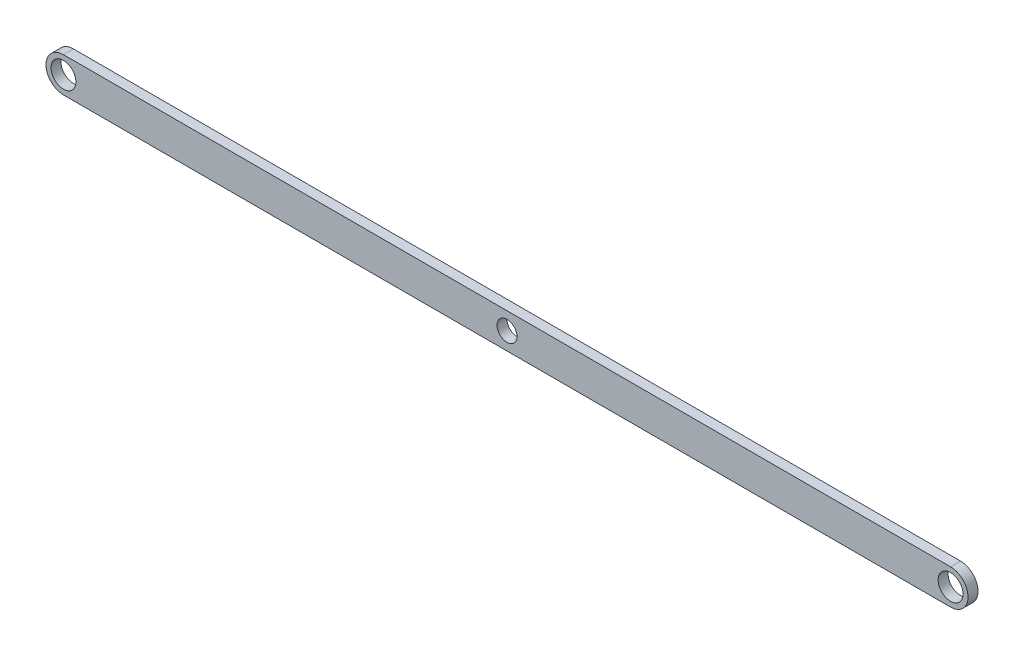
from build123d import *

# Parameters (mm, degrees)
SKETCH_1_R      = 2.5
SKETCH_1_R_2    = 2
EXTRUDE_1_DEPTH = 2


with BuildPart() as part:
    # 스케치1 → 보스-돌출1 (new body)
    with BuildSketch(Plane.XY):
        with BuildLine():
            Line((-92.261550106, 23.229064941), (85.738449894, 23.229064941))
            ThreePointArc((85.738449894, 23.229064941), (89.238449894, 19.729064941), (85.738449894, 16.229064941))
            Line((85.738449894, 16.229064941), (-92.261550106, 16.229064941))
            ThreePointArc((-92.261550106, 16.229064941), (-95.761550106, 19.729064941), (-92.261550106, 23.229064941))
        make_face()
        with Locations((-92.261550106, 19.729064941)):
            Circle(SKETCH_1_R, mode=Mode.SUBTRACT)
        with Locations((85.738449894, 19.729064941)):
            Circle(SKETCH_1_R, mode=Mode.SUBTRACT)
        with Locations((-3.261550106, 19.729064941)):
            Circle(SKETCH_1_R_2, mode=Mode.SUBTRACT)
    extrude(amount=EXTRUDE_1_DEPTH)


solid = part.part
